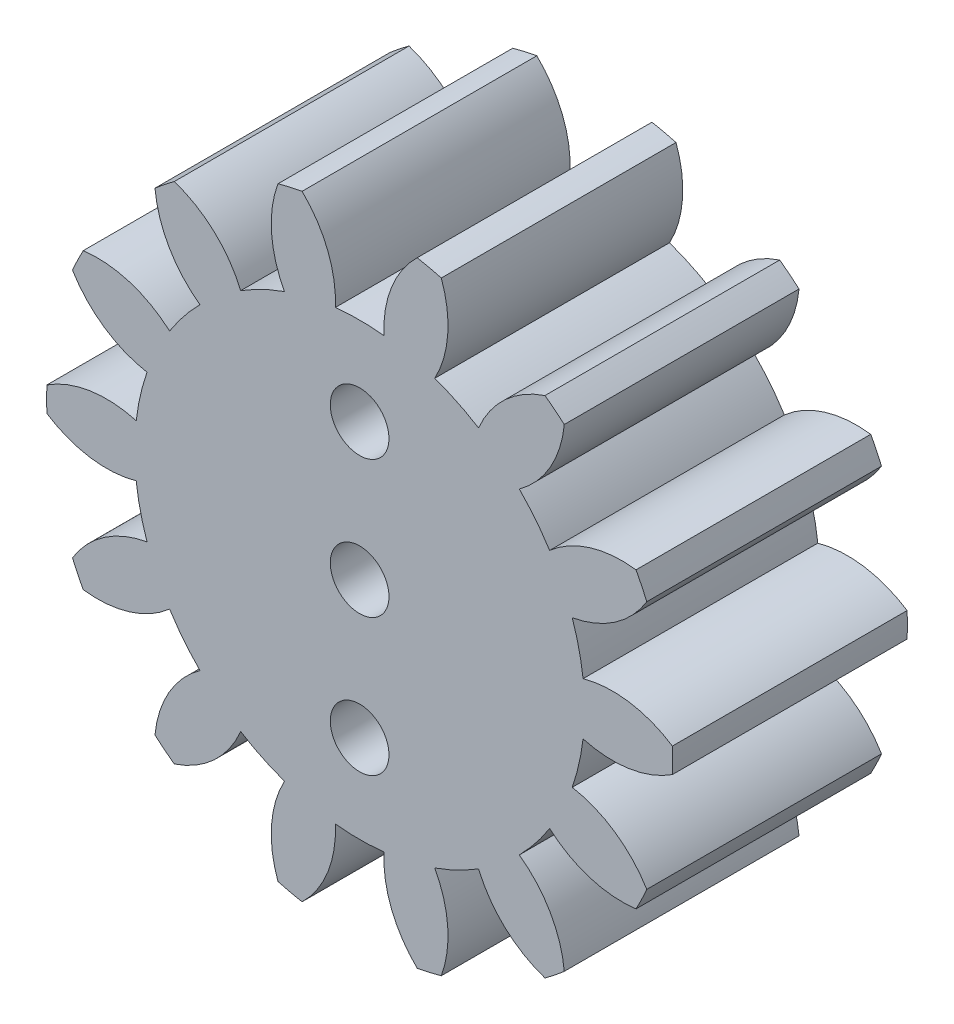
from build123d import *

# Parameters (mm, degrees)
CROQUIS1_R              = 1.5
SALIENTE_EXTRUIR1_DEPTH = 12
CROQUIS2_R              = 1.5
CORTAR_EXTRUIR1_DEPTH   = 26.442992774


with BuildPart() as part:
    # Croquis1 → Saliente-Extruir1 (new body)
    with BuildSketch(Plane.XY):
        with BuildLine():
            ThreePointArc((-14.13022151, -7.505787105), (-11.775764132, -7.307322196), (-9.712736286, -6.155465444))
            ThreePointArc((-9.712736286, -6.155465444), (-8.990280217, -7.169509232), (-8.162422223, -8.09949779))
            ThreePointArc((-8.162422223, -8.09949779), (-9.744466405, -9.854488979), (-10.461871439, -12.105752599))
            ThreePointArc((-10.461871439, -12.105752599), (-9.97583683, -12.509303719), (-9.474250703, -12.893353854))
            ThreePointArc((-9.474250703, -12.893353854), (-7.439068601, -11.692982379), (-6.080116654, -9.760081069))
            ThreePointArc((-6.080116654, -9.760081069), (-4.989229116, -10.360241012), (-3.839847924, -10.838937629))
            ThreePointArc((-3.839847924, -10.838937629), (-4.50375834, -13.106553299), (-4.173331264, -15.446142112))
            ThreePointArc((-4.173331264, -15.446142112), (-3.560334943, -15.598846595), (-2.94178835, -15.727233746))
            ThreePointArc((-2.94178835, -15.727233746), (-1.6289743, -13.762703997), (-1.24325535, -11.43159294))
            ThreePointArc((-1.24325535, -11.43159294), (0, -11.499), (1.24325535, -11.43159294))
            ThreePointArc((1.24325535, -11.43159294), (1.6289743, -13.762703997), (2.94178835, -15.727233746))
            ThreePointArc((2.94178835, -15.727233746), (3.560334943, -15.598846595), (4.173331264, -15.446142112))
            ThreePointArc((4.173331264, -15.446142112), (4.50375834, -13.106553299), (3.839847924, -10.838937629))
            ThreePointArc((3.839847924, -10.838937629), (4.989229116, -10.360241012), (6.080116654, -9.760081069))
            ThreePointArc((6.080116654, -9.760081069), (7.439068601, -11.692982379), (9.474250703, -12.893353854))
            ThreePointArc((9.474250703, -12.893353854), (9.97583683, -12.509303719), (10.461871439, -12.105752599))
            ThreePointArc((10.461871439, -12.105752599), (9.744466405, -9.854488979), (8.162422223, -8.09949779))
            ThreePointArc((8.162422223, -8.09949779), (8.990280217, -7.169509232), (9.712736286, -6.155465444))
            ThreePointArc((9.712736286, -6.155465444), (11.775764132, -7.307322196), (14.13022151, -7.505787105))
            ThreePointArc((14.13022151, -7.505787105), (14.415501886, -6.942139826), (14.678309669, -6.367670316))
            ThreePointArc((14.678309669, -6.367670316), (13.055163391, -4.65062226), (10.868328696, -3.75585308))
            ThreePointArc((10.868328696, -3.75585308), (11.210696062, -2.55876822), (11.421629379, -1.331684395))
            ThreePointArc((11.421629379, -1.331684395), (13.780125156, -1.474357234), (15.987528652, -0.631607167))
            ThreePointArc((15.987528652, -0.631607167), (16, 0), (15.987528652, 0.631607167))
            ThreePointArc((15.987528652, 0.631607167), (13.780125156, 1.474357234), (11.421629379, 1.331684395))
            ThreePointArc((11.421629379, 1.331684395), (11.210696062, 2.55876822), (10.868328696, 3.75585308))
            ThreePointArc((10.868328696, 3.75585308), (13.055163391, 4.65062226), (14.678309669, 6.367670316))
            ThreePointArc((14.678309669, 6.367670316), (14.415501886, 6.942139826), (14.13022151, 7.505787105))
            ThreePointArc((14.13022151, 7.505787105), (11.775764132, 7.307322196), (9.712736286, 6.155465444))
            ThreePointArc((9.712736286, 6.155465444), (8.990280217, 7.169509232), (8.162422223, 8.09949779))
            ThreePointArc((8.162422223, 8.09949779), (9.744466405, 9.854488979), (10.461871439, 12.105752599))
            ThreePointArc((10.461871439, 12.105752599), (9.97583683, 12.509303719), (9.474250703, 12.893353854))
            ThreePointArc((9.474250703, 12.893353854), (7.439068601, 11.692982379), (6.080116654, 9.760081069))
            ThreePointArc((6.080116654, 9.760081069), (4.989229116, 10.360241012), (3.839847924, 10.838937629))
            ThreePointArc((3.839847924, 10.838937629), (4.50375834, 13.106553299), (4.173331264, 15.446142112))
            ThreePointArc((4.173331264, 15.446142112), (3.560334943, 15.598846595), (2.94178835, 15.727233746))
            ThreePointArc((2.94178835, 15.727233746), (1.6289743, 13.762703997), (1.24325535, 11.43159294))
            ThreePointArc((1.24325535, 11.43159294), (0, 11.499), (-1.24325535, 11.43159294))
            ThreePointArc((-1.24325535, 11.43159294), (-1.6289743, 13.762703997), (-2.94178835, 15.727233746))
            ThreePointArc((-2.94178835, 15.727233746), (-3.560334943, 15.598846595), (-4.173331264, 15.446142112))
            ThreePointArc((-4.173331264, 15.446142112), (-4.50375834, 13.106553299), (-3.839847924, 10.838937629))
            ThreePointArc((-3.839847924, 10.838937629), (-4.989229116, 10.360241012), (-6.080116654, 9.760081069))
            ThreePointArc((-6.080116654, 9.760081069), (-7.439068601, 11.692982379), (-9.474250703, 12.893353854))
            ThreePointArc((-9.474250703, 12.893353854), (-9.97583683, 12.509303719), (-10.461871439, 12.105752599))
            ThreePointArc((-10.461871439, 12.105752599), (-9.744466405, 9.854488979), (-8.162422223, 8.09949779))
            ThreePointArc((-8.162422223, 8.09949779), (-8.990280217, 7.169509232), (-9.712736286, 6.155465444))
            ThreePointArc((-9.712736286, 6.155465444), (-11.775764132, 7.307322196), (-14.13022151, 7.505787105))
            ThreePointArc((-14.13022151, 7.505787105), (-14.415501886, 6.942139826), (-14.678309669, 6.367670316))
            ThreePointArc((-14.678309669, 6.367670316), (-13.055163391, 4.65062226), (-10.868328696, 3.75585308))
            ThreePointArc((-10.868328696, 3.75585308), (-11.210696062, 2.55876822), (-11.421629379, 1.331684395))
            ThreePointArc((-11.421629379, 1.331684395), (-13.780125156, 1.474357234), (-15.987528652, 0.631607167))
            ThreePointArc((-15.987528652, 0.631607167), (-16, 0), (-15.987528652, -0.631607167))
            ThreePointArc((-15.987528652, -0.631607167), (-13.780125156, -1.474357234), (-11.421629379, -1.331684395))
            ThreePointArc((-11.421629379, -1.331684395), (-11.210696062, -2.55876822), (-10.868328696, -3.75585308))
            ThreePointArc((-10.868328696, -3.75585308), (-13.055163391, -4.65062226), (-14.678309669, -6.367670316))
            ThreePointArc((-14.678309669, -6.367670316), (-14.415501886, -6.942139826), (-14.13022151, -7.505787105))
        make_face()
        Circle(CROQUIS1_R, mode=Mode.SUBTRACT)
    extrude(amount=SALIENTE_EXTRUIR1_DEPTH)

    # Croquis2 → Cortar-Extruir1 (cut, through all)
    with BuildSketch(Plane(origin=(0, 0, 0), x_dir=(-1, 0, 0), z_dir=(0, 0, -1))):
        with Locations((0, 7)):
            Circle(CROQUIS2_R)
        with Locations((0, -7)):
            Circle(CROQUIS2_R)
    extrude(amount=-CORTAR_EXTRUIR1_DEPTH, mode=Mode.SUBTRACT)


solid = part.part
